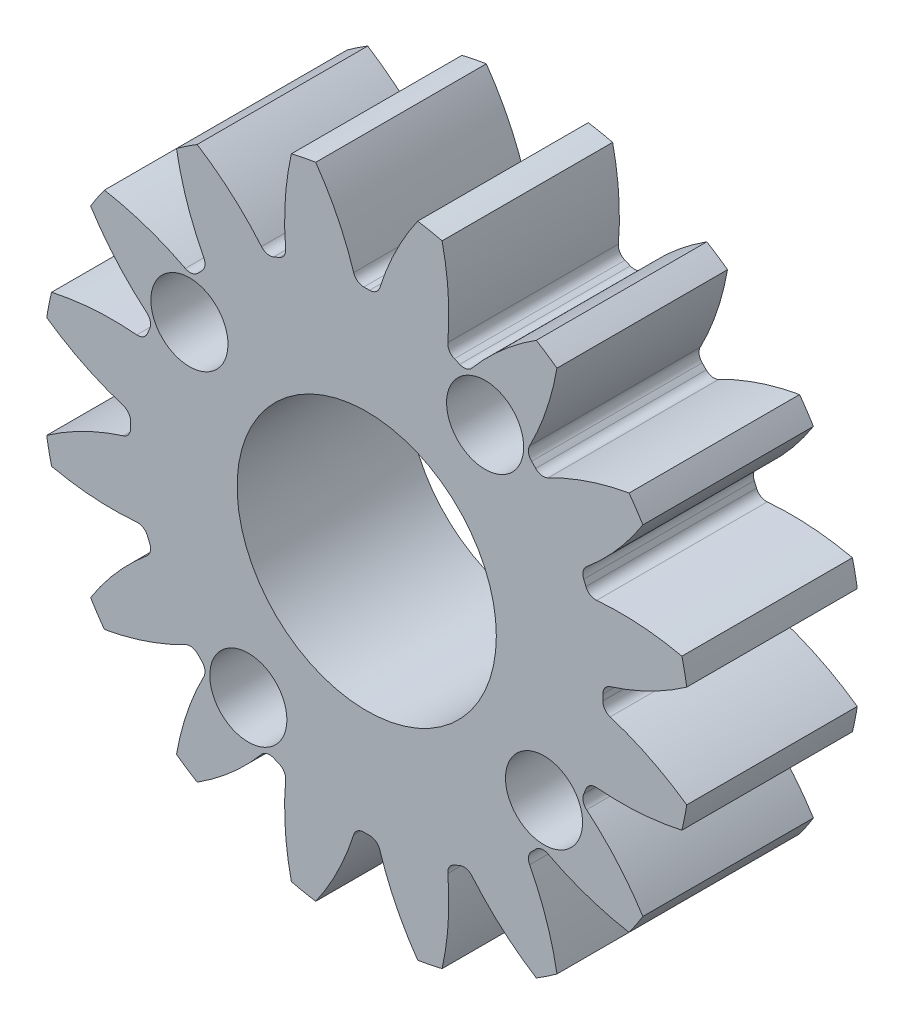
from build123d import *

# Parameters (mm, degrees)
FILLET2_R           = 0.2413
CUT_EXTRUDE2_DEPTH  = 26.574028913
CIRPATTERN1_COUNT   = 16
SKETCH10_R          = 29.093421686
CUT_EXTRUDE3_DEPTH  = 15.24
SKETCH11_R          = 20.555223038
CUT_EXTRUDE4_DEPTH  = 10.16
SKETCH12_R          = 7.917123479
SKETCH12_R_2        = 4.826
BOSS_EXTRUDE1_DEPTH = 6.35
SKETCH_1_R          = 1.4351
CUT_EXTRUDE_1_DEPTH = 24.590352248


with BuildPart() as part:
    # Sketch4 → Revolve1 (revolve)
    with BuildSketch(Plane(origin=(0, 0, 0), x_dir=(0, 0, -1), z_dir=(1, 0, 0))):
        Polygon((-31.75, 6.35), (-31.75, 10.3251), (-19.05, 10.3251), (-19.05, 12.065), (0, 12.065), (0, 6.35), align=None)
    revolve(axis=Axis((0, 0, 19.05), (0, 0, 1)))

    # Fillet2
    fillet2_edges = [part.edges().sort_by_distance(p)[0] for p in [
        (0, -12.065, 0),
        (0, -12.065, 19.05),
        (0, -10.3251, 19.05),
        (0, -10.3251, 31.75),
    ]]
    fillet(fillet2_edges, radius=FILLET2_R)

    # Sketch7 → Cut-Extrude2 (cut, through all)
    with BuildSketch(Plane.XY.offset(19.05)):
        with BuildLine():
            ThreePointArc((-0.107661594, 8.790121954), (0, 8.79078125), (0.107661594, 8.790121954))
            ThreePointArc((0.107661594, 8.790121954), (0.342591452, 8.864525037), (0.487011309, 9.064201678))
            ThreePointArc((0.487011309, 9.064201678), (1.083642605, 10.543346068), (1.897871283, 11.914793728))
            ThreePointArc((1.897871283, 11.914793728), (0, 12.065), (-1.897871283, 11.914793728))
            ThreePointArc((-1.897871283, 11.914793728), (-1.083642605, 10.543346068), (-0.487011309, 9.064201678))
            ThreePointArc((-0.487011309, 9.064201678), (-0.342591452, 8.864525037), (-0.107661594, 8.790121954))
        make_face()
    cut_extrude2 = extrude(amount=-CUT_EXTRUDE2_DEPTH, mode=Mode.SUBTRACT)

    # CirPattern1: Cut-Extrude2 ×16 about axis
    cirpattern1_axis = Axis((0, 0, 0), (0, 0, 1))
    for i in range(1, CIRPATTERN1_COUNT):
        add(cut_extrude2.rotate(cirpattern1_axis, i * 360 / CIRPATTERN1_COUNT), mode=Mode.SUBTRACT)

    # Sketch10 → Cut-Extrude3 (cut)
    with BuildSketch(Plane.XY.offset(31.75)):
        Circle(SKETCH10_R)
    extrude(amount=-CUT_EXTRUDE3_DEPTH, mode=Mode.SUBTRACT)

    # Sketch11 → Cut-Extrude4 (cut)
    with BuildSketch(Plane(origin=(0, 0, 0), x_dir=(-1, 0, 0), z_dir=(0, 0, -1))):
        Circle(SKETCH11_R)
    extrude(amount=-CUT_EXTRUDE4_DEPTH, mode=Mode.SUBTRACT)

    # Sketch12 → Boss-Extrude1 (add)
    with BuildSketch(Plane.XY.offset(16.51)):
        Circle(SKETCH12_R)
        Circle(SKETCH12_R_2, mode=Mode.SUBTRACT)
    extrude(amount=-BOSS_EXTRUDE1_DEPTH)

    # Эскиз1 → Вырез-Вытянуть1 (cut, through all)
    with BuildSketch(Plane(origin=(0, 0, 0), x_dir=(-1, 0, 0), z_dir=(0, 0, -1))):
        with Locations(Location((6.601034981, 4.40797498, 0), (0, 0, 90))):
            Circle(SKETCH_1_R)
        with Locations(Location((4.40797498, -6.601034981, 0), (0, 0, 90))):
            Circle(SKETCH_1_R)
        with Locations(Location((-6.601034981, -4.40797498, 0), (0, 0, 90))):
            Circle(SKETCH_1_R)
        with Locations(Location((-4.40797498, 6.601034981, 0), (0, 0, 90))):
            Circle(SKETCH_1_R)
    extrude(amount=-CUT_EXTRUDE_1_DEPTH, mode=Mode.SUBTRACT)


solid = part.part
